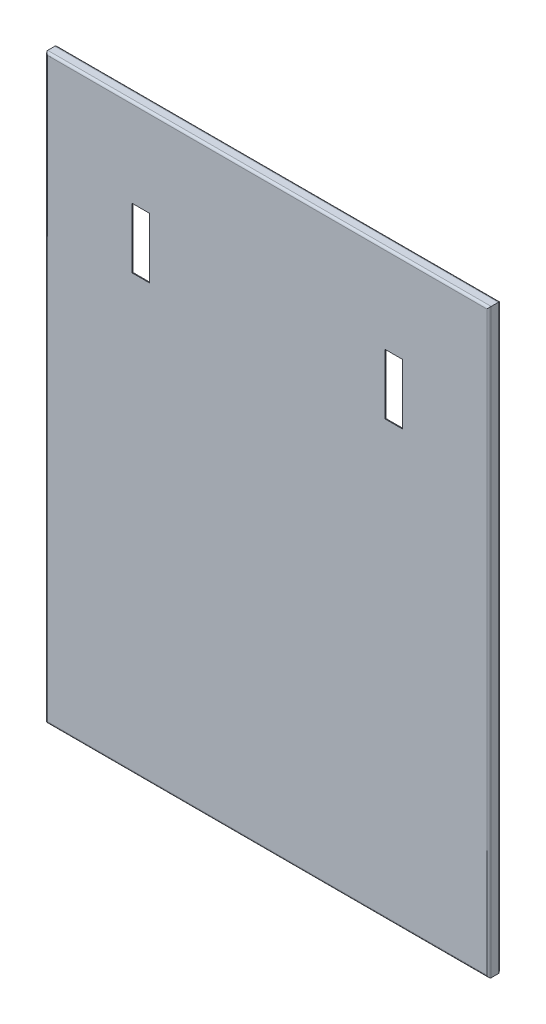
from build123d import *

# Parameters (mm, degrees)
SKETCH_1_W      = 640
SKETCH_1_H      = 839
SKETCH_1_W_2    = 25
SKETCH_1_H_2    = 87
EXTRUDE_1_DEPTH = 1.2
SKETCH_2_W      = 640
SKETCH_2_H      = 839
SKETCH_2_W_2    = 637.6
SKETCH_2_H_2    = 836.6
EXTRUDE_2_DEPTH = 15.5
SKETCH_3_W      = 640
SKETCH_3_H      = 839
SKETCH_3_W_2    = 610
SKETCH_3_H_2    = 809
EXTRUDE_3_DEPTH = 1.2
FILLET_1_R      = 2
FILLET_2_R      = 3.2
FILLET_3_R      = 3.2


with BuildPart() as part:
    # 스케치1 → 보스-돌출1 (new body)
    with BuildSketch(Plane.XY):
        with Locations((320, 419.5)):
            Rectangle(SKETCH_1_W, SKETCH_1_H)
        with Locations((137.5, 668.5)):
            Rectangle(SKETCH_1_W_2, SKETCH_1_H_2, mode=Mode.SUBTRACT)
        with Locations((502.5, 668.5)):
            Rectangle(SKETCH_1_W_2, SKETCH_1_H_2, mode=Mode.SUBTRACT)
    extrude(amount=EXTRUDE_1_DEPTH)

    # 스케치2 → 보스-돌출2 (add)
    with BuildSketch(Plane(origin=(0, 0, 0), x_dir=(-1, 0, 0), z_dir=(0, 0, -1))):
        with Locations((-320, 419.5)):
            Rectangle(SKETCH_2_W, SKETCH_2_H)
        with Locations((-320, 419.5)):
            Rectangle(SKETCH_2_W_2, SKETCH_2_H_2, mode=Mode.SUBTRACT)
    extrude(amount=EXTRUDE_2_DEPTH)

    # 스케치3 → 보스-돌출3 (add)
    with BuildSketch(Plane(origin=(0, 0, -15.5), x_dir=(-1, 0, 0), z_dir=(0, 0, -1))):
        with Locations((-320, 419.5)):
            Rectangle(SKETCH_3_W, SKETCH_3_H)
        with Locations((-320, 419.5)):
            Rectangle(SKETCH_3_W_2, SKETCH_3_H_2, mode=Mode.SUBTRACT)
    extrude(amount=-EXTRUDE_3_DEPTH)

    # 필렛1
    fillet_1_edges = [part.edges().sort_by_distance(p)[0] for p in [
        (1.2, 419.5, 0),
        (320, 837.8, 0),
        (638.8, 419.5, 0),
        (320, 1.2, 0),
        (638.8, 1.2, -7.15),
        (1.2, 1.2, -7.15),
        (320, 1.2, -14.3),
        (638.8, 837.8, -7.15),
        (1.2, 837.8, -7.15),
        (1.2, 419.5, -14.3),
        (320, 837.8, -14.3),
        (638.8, 419.5, -14.3),
    ]]
    fillet(fillet_1_edges, radius=FILLET_1_R)

    # 필렛2
    fillet_2_edges = [part.edges().sort_by_distance(p)[0] for p in [
        (640, 419.5, 1.2),
        (320, 839, 1.2),
        (0, 419.5, 1.2),
        (320, 0, 1.2),
    ]]
    fillet(fillet_2_edges, radius=FILLET_2_R)

    # 필렛3
    fillet_3_edges = [part.edges().sort_by_distance(p)[0] for p in [
        (320, 0, -15.5),
        (0, 419.5, -15.5),
        (320, 839, -15.5),
        (640, 419.5, -15.5),
    ]]
    fillet(fillet_3_edges, radius=FILLET_3_R)


solid = part.part
